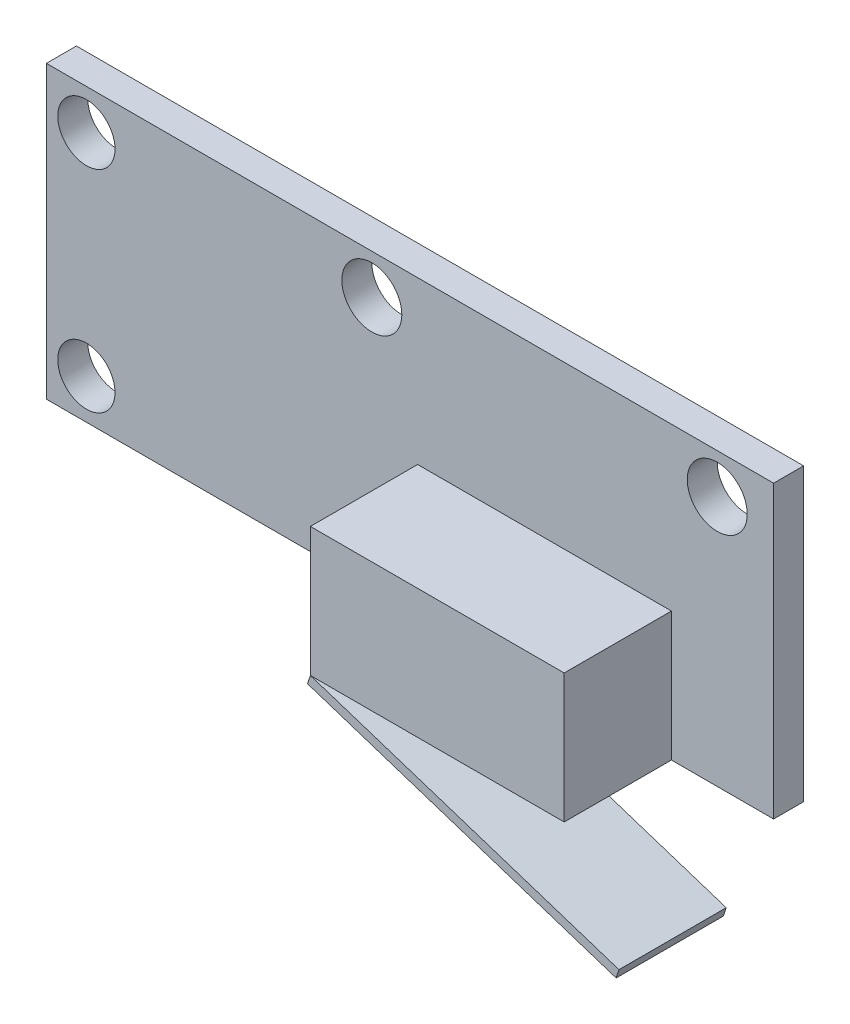
from build123d import *

# Parameters (mm, degrees)
SCHIZZO1_W                   = 40
SCHIZZO1_H                   = 16
SCHIZZO1_R                   = 1.65
SCHIZZO1_R_2                 = 1.575
ESTRUSIONE_ESTRUSIONE1_DEPTH = 1.65
SCHIZZO2_W                   = 13.961540804
SCHIZZO2_H                   = 7.099301817
ESTRUSIONE_ESTRUSIONE2_DEPTH = 5.9
ESTRUSIONE_SOTTILE1_DEPTH    = 5.9


with BuildPart() as part:
    # Schizzo1 → Estrusione-Estrusione1 (new body)
    with BuildSketch(Plane.XY):
        with Locations((20, 8)):
            Rectangle(SCHIZZO1_W, SCHIZZO1_H)
        with Locations((36.9, 13.8)):
            Circle(SCHIZZO1_R, mode=Mode.SUBTRACT)
        with Locations((17.9, 13.8)):
            Circle(SCHIZZO1_R, mode=Mode.SUBTRACT)
        with Locations((2.2, 13.8)):
            Circle(SCHIZZO1_R_2, mode=Mode.SUBTRACT)
        with Locations(Location((2.2, 2.2, 0), (0, 0, 180))):
            Circle(SCHIZZO1_R_2, mode=Mode.SUBTRACT)
    extrude(amount=ESTRUSIONE_ESTRUSIONE1_DEPTH)

    # Schizzo2 → Estrusione-Estrusione2 (add)
    with BuildSketch(Plane.XY.offset(1.65)):
        with Locations((27.4, 3.549650909)):
            Rectangle(SCHIZZO2_W, SCHIZZO2_H)
    extrude(amount=ESTRUSIONE_ESTRUSIONE2_DEPTH)


with BuildPart() as body_2:
    # Schizzo3 → Estrusione-Sottile1 (new body)
    with BuildSketch(Plane.XY.offset(1.65)):
        Polygon((20.419229598, 0), (37.394068881, -5.527143905), (37.23926441, -6.002575893), (20.264425127, -0.475431989), align=None)
    extrude(amount=ESTRUSIONE_SOTTILE1_DEPTH)


solid = Compound([part.part, body_2.part])
